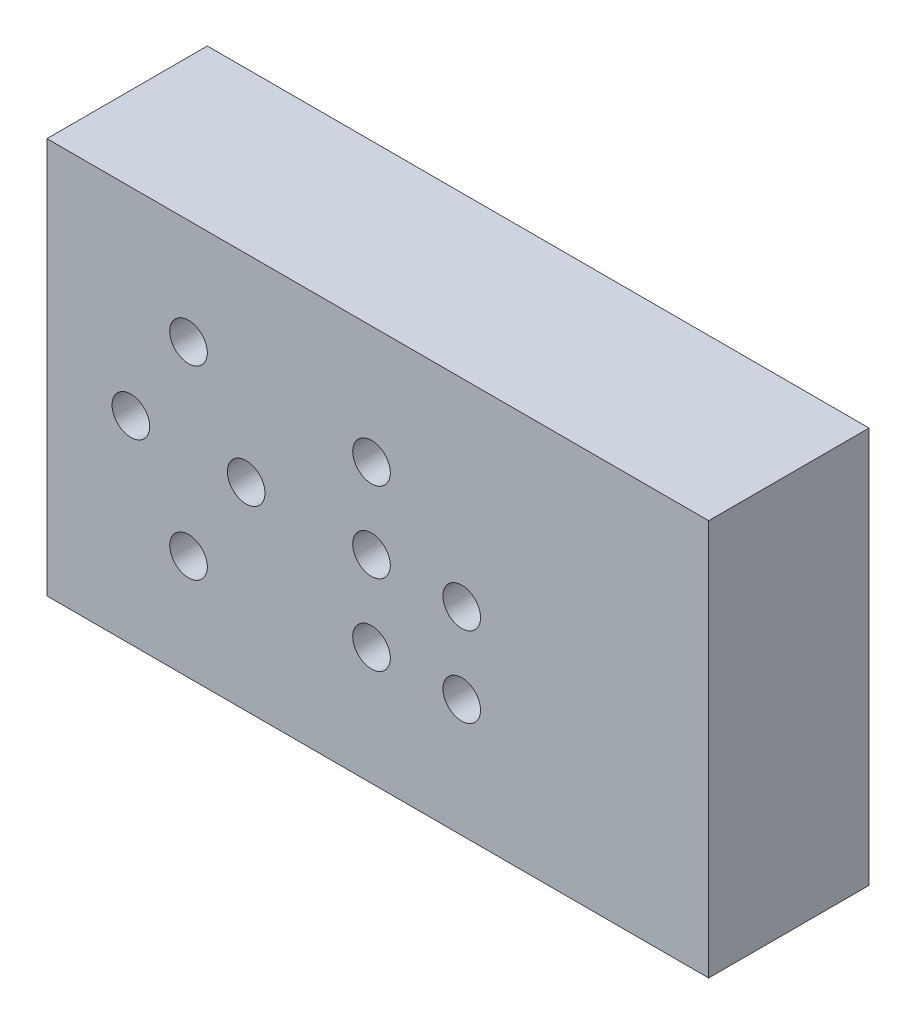
from build123d import *

# Parameters (mm, degrees)
SKETCH1_W           = 132
SKETCH1_H           = 79
BOSS_EXTRUDE2_DEPTH = 32
SKETCH1_6_R         = 3.75
CUT_EXTRUDE15_DEPTH = 42


with BuildPart() as part:
    # Sketch1 → Boss-Extrude2 (new body)
    with BuildSketch(Plane.XY):
        with Locations((-7.24491948, 0)):
            Rectangle(SKETCH1_W, SKETCH1_H)
    extrude(amount=BOSS_EXTRUDE2_DEPTH)

    # Sketch1<6> → Cut-Extrude15 (cut)
    with BuildSketch(Plane.XY):
        with Locations((-45, 18.5)):
            Circle(SKETCH1_6_R)
        with Locations((-45, -18.5)):
            Circle(SKETCH1_6_R)
        with Locations((-56.5, 0)):
            Circle(SKETCH1_6_R)
        with Locations((-33.5, 0)):
            Circle(SKETCH1_6_R)
        with Locations((-8.5, 0)):
            Circle(SKETCH1_6_R)
        with Locations((-8.5, -16)):
            Circle(SKETCH1_6_R)
        with Locations((-8.5, 16)):
            Circle(SKETCH1_6_R)
        with Locations((9.5, -16)):
            Circle(SKETCH1_6_R)
        with Locations((9.5, 0)):
            Circle(SKETCH1_6_R)
    extrude(amount=CUT_EXTRUDE15_DEPTH, mode=Mode.SUBTRACT)


solid = part.part
